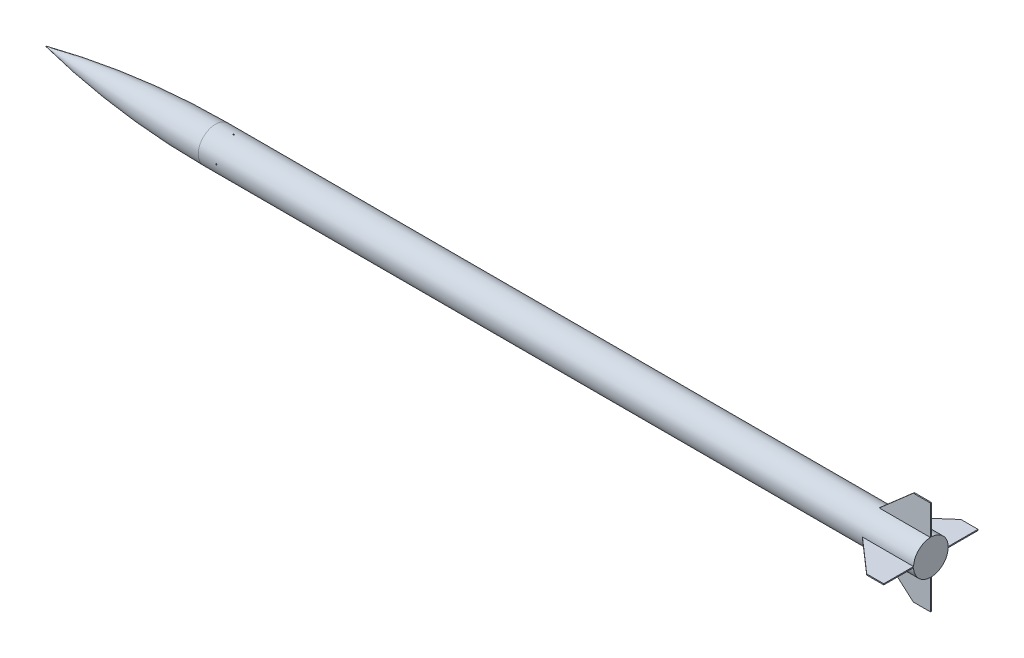
from build123d import *

# Parameters (mm, degrees)
BOSS_EXTRUDE2_DEPTH = 1.5875
CIRPATTERN4_COUNT   = 4
SKETCH3_R           = 1.59766
CUT_EXTRUDE1_DEPTH  = 76.2
SKETCH4_R           = 1.59766
CUT_EXTRUDE2_DEPTH  = 76.2


with BuildPart() as part:
    # Sketch1 → Revolve10 (revolve)
    with BuildSketch(Plane.XY, mode=Mode.PRIVATE) as revolve10_sk:
        with BuildLine():
            Line((2133.600000001, 1e-09), (-505.471328691, 1e-09))
            ThreePointArc((-505.471328691, 1e-09), (-505.328221022, -0.401580545), (-504.963401337, -0.62215556))
            ThreePointArc((-504.963401337, -0.62215556), (-253.7682337, -38.870810982), (0, -51.663599999))
            Line((0, -51.663599999), (2133.600000001, -51.663599999))
            Line((2133.600000001, -51.663599999), (2133.600000001, 1e-09))
        make_face()
    revolve(revolve10_sk.sketch.rotate(Axis((2133.600000001, 1e-09, 0), (-1, 0, 0)), 180), axis=Axis((2133.600000001, 1e-09, 0), (-1, 0, 0)))

    # Sketch3 → Cut-Extrude1 (cut, symmetric)
    with BuildSketch(Plane.XY):
        with Locations((53.836598663, 0.622155562)):
            Circle(SKETCH3_R)
    extrude(amount=CUT_EXTRUDE1_DEPTH, both=True, mode=Mode.SUBTRACT)

    # Sketch4 → Cut-Extrude2 (cut, symmetric)
    with BuildSketch(Plane(origin=(0, 0, 0), x_dir=(1, 0, 0), z_dir=(0, 1, 0))):
        with Locations(Location((53.836671309, 0, 0), (0, 0, 270))):
            Circle(SKETCH4_R)
    extrude(amount=CUT_EXTRUDE2_DEPTH, both=True, mode=Mode.SUBTRACT)


with BuildPart() as body_2:
    # Sketch2 → Boss-Extrude2 (new, symmetric)
    with BuildSketch(Plane.XY):
        Polygon((1981.200000001, 51.663600001), (2133.600000001, 51.663600001), (2133.600000001, 140.563600001), (2082.800000001, 140.563600001), align=None)
    extrude(amount=BOSS_EXTRUDE2_DEPTH, both=True)


with BuildPart() as cirpattern4_1:
    # CirPattern4: pattern copy
    add(body_2.part.rotate(Axis((0, 0, 0), (1, 0, 0)), 1 * 360 / CIRPATTERN4_COUNT))


with BuildPart() as cirpattern4_2:
    # CirPattern4: pattern copy
    add(body_2.part.rotate(Axis((0, 0, 0), (1, 0, 0)), 2 * 360 / CIRPATTERN4_COUNT))


with BuildPart() as cirpattern4_3:
    # CirPattern4: pattern copy
    add(body_2.part.rotate(Axis((0, 0, 0), (1, 0, 0)), 3 * 360 / CIRPATTERN4_COUNT))


solid = Compound([part.part, body_2.part, cirpattern4_1.part, cirpattern4_2.part, cirpattern4_3.part])
